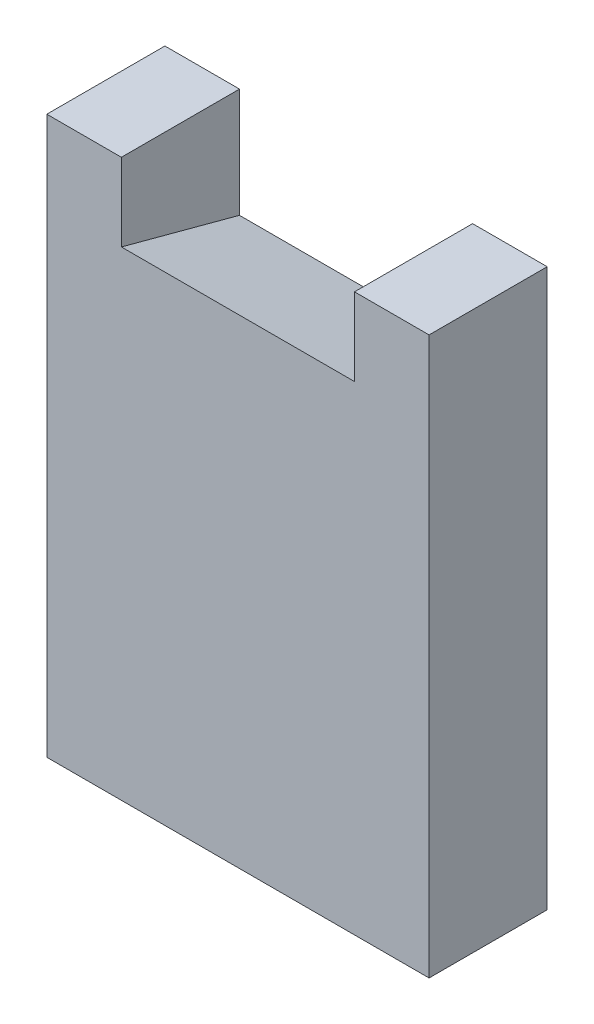
from build123d import *

# Parameters (mm, degrees)
EXTRUDE_1_DEPTH = 7.6
DRAFT_5_ANGLE   = -15


with BuildPart() as part:
    # 草图1 → 凸台-拉伸1 (new body)
    with BuildSketch(Plane.XY):
        Polygon((4.8, 0), (0, 0), (0, -35.84), (24.6, -35.84), (24.6, 0), (19.8, 0), (19.8, -5), (4.8, -5), align=None)
    extrude(amount=EXTRUDE_1_DEPTH)

    # 拔模5
    draft_5_faces = [part.faces().sort_by_distance(p)[0] for p in [
        (12.3, -5, 3.8),
    ]]
    draft(draft_5_faces, Plane.XY.offset(7.6), DRAFT_5_ANGLE)


solid = part.part
